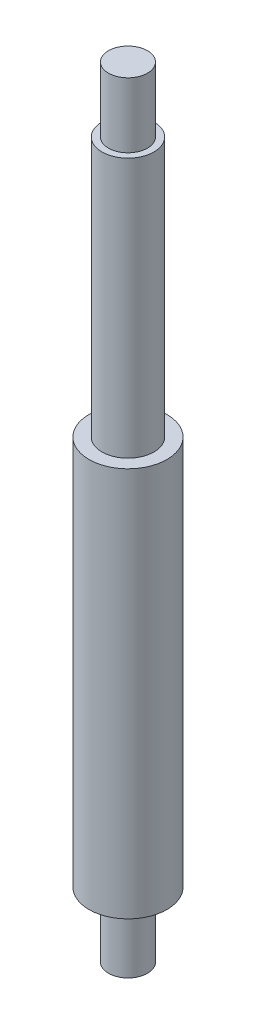
from build123d import *

# Parameters (mm, degrees)
SKETCH_1_R      = 3
EXTRUDE_1_DEPTH = 10
SKETCH_7_R      = 6
EXTRUDE_2_DEPTH = 60
SKETCH_8_R      = 4
EXTRUDE_3_DEPTH = 40
SKETCH_9_R      = 3
EXTRUDE_4_DEPTH = 10


with BuildPart() as part:
    # 草图1 → 凸台-拉伸1 (new body)
    with BuildSketch(Plane(origin=(0, 0, 0), x_dir=(1, 0, 0), z_dir=(0, 1, 0))):
        with Locations(Location((0, 0, 0), (0, 0, 270))):
            Circle(SKETCH_1_R)
    extrude(amount=EXTRUDE_1_DEPTH)

    # 草图7 → 凸台-拉伸2 (add)
    with BuildSketch(Plane(origin=(0, 10, 0), x_dir=(1, 0, 0), z_dir=(0, 1, 0))):
        with Locations(Location((0, 0, 0), (0, 0, 270))):
            Circle(SKETCH_7_R)
    extrude(amount=EXTRUDE_2_DEPTH)

    # 草图8 → 凸台-拉伸3 (add)
    with BuildSketch(Plane(origin=(0, 70, 0), x_dir=(1, 0, 0), z_dir=(0, 1, 0))):
        with Locations(Location((0, 0, 0), (0, 0, 270))):
            Circle(SKETCH_8_R)
    extrude(amount=EXTRUDE_3_DEPTH)

    # 草图9 → 凸台-拉伸4 (add)
    with BuildSketch(Plane(origin=(0, 110, 0), x_dir=(-1, 0, 0), z_dir=(0, 1, 0))):
        with Locations(Location((0, 0, 0), (0, 0, 90))):
            Circle(SKETCH_9_R)
    extrude(amount=EXTRUDE_4_DEPTH)


solid = part.part
